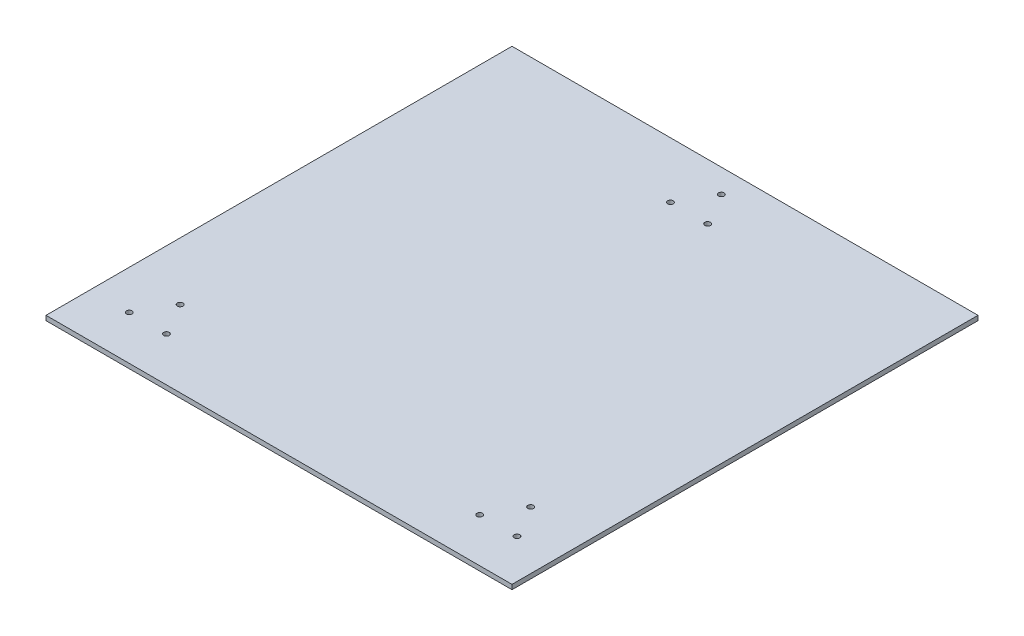
from build123d import *

# Parameters (mm, degrees)
SKETCH_1_W      = 250
SKETCH_1_H      = 250
SKETCH_1_R      = 1.5
EXTRUDE_1_DEPTH = 2.5


with BuildPart() as part:
    # Эскиз1 → Бобышка-Вытянуть1 (new body)
    with BuildSketch(Plane(origin=(0, 0, 0), x_dir=(1, 0, 0), z_dir=(0, 1, 0))):
        with Locations((125, 125)):
            Rectangle(SKETCH_1_W, SKETCH_1_H)
        with Locations(Location((125, 237.3, 0), (0, 0, 270))):
            Circle(SKETCH_1_R, mode=Mode.SUBTRACT)
        with Locations(Location((135, 219.979491924, 0), (0, 0, 270))):
            Circle(SKETCH_1_R, mode=Mode.SUBTRACT)
        with Locations(Location((115, 219.979491924, 0), (0, 0, 270))):
            Circle(SKETCH_1_R, mode=Mode.SUBTRACT)
        with Locations(Location((30.98120212, 40.981016151, 0), (0, 0, 270))):
            Circle(SKETCH_1_R, mode=Mode.SUBTRACT)
        with Locations(Location((40.98120212, 23.660508076, 0), (0, 0, 270))):
            Circle(SKETCH_1_R, mode=Mode.SUBTRACT)
        with Locations(Location((20.98120212, 23.660508076, 0), (0, 0, 270))):
            Circle(SKETCH_1_R, mode=Mode.SUBTRACT)
        with Locations(Location((219.01879788, 40.981016151, 0), (0, 0, 270))):
            Circle(SKETCH_1_R, mode=Mode.SUBTRACT)
        with Locations(Location((229.01879788, 23.660508076, 0), (0, 0, 270))):
            Circle(SKETCH_1_R, mode=Mode.SUBTRACT)
        with Locations(Location((209.01879788, 23.660508076, 0), (0, 0, 270))):
            Circle(SKETCH_1_R, mode=Mode.SUBTRACT)
    extrude(amount=EXTRUDE_1_DEPTH)


solid = part.part
